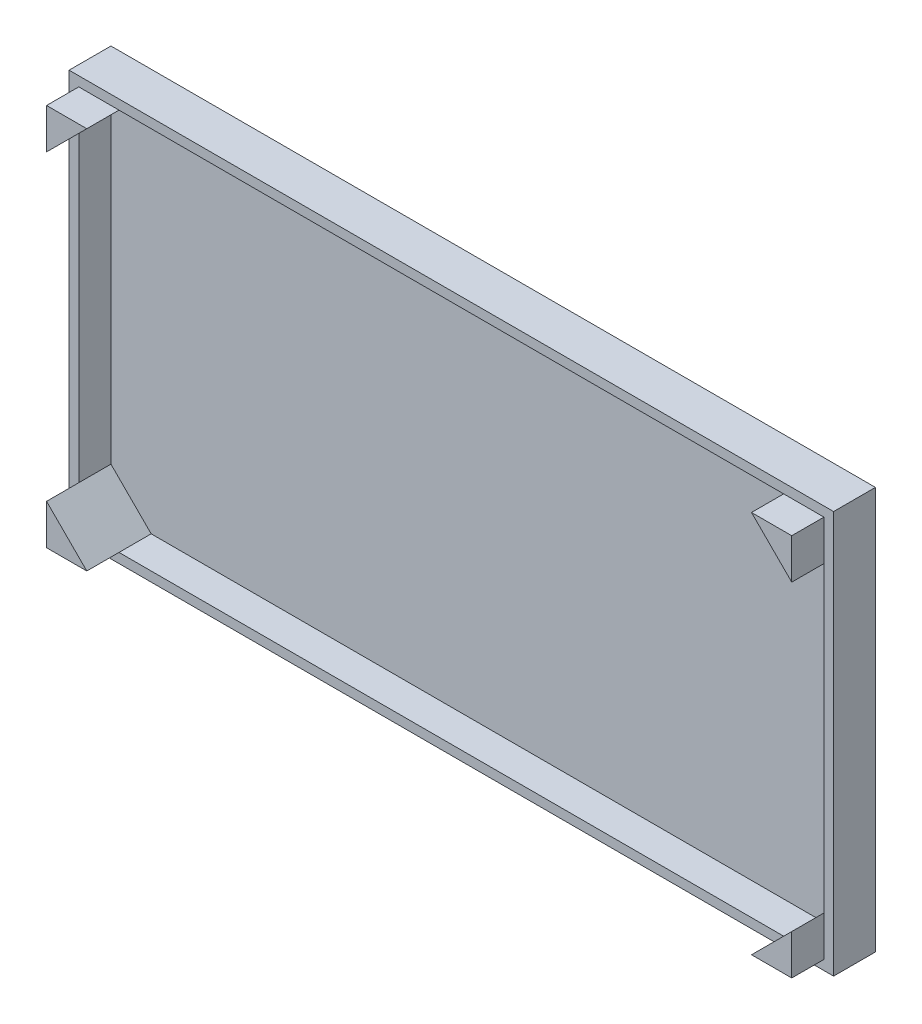
from build123d import *

# Parameters (mm, degrees)
SKICA1_W                = 95
SKICA1_H                = 50
P_IDAT_VYSUNUT_M1_DEPTH = 1.2
SKICA2_W                = 95
SKICA2_H                = 50
SKICA2_W_2              = 92.6
SKICA2_H_2              = 47.6
P_IDAT_VYSUNUT_M2_DEPTH = 4
P_IDAT_VYSUNUT_M3_DEPTH = 8


with BuildPart() as part:
    # Skica1 → Přidat vysunutím1 (new body)
    with BuildSketch(Plane.XY):
        with Locations((47.5, 25)):
            Rectangle(SKICA1_W, SKICA1_H)
    extrude(amount=P_IDAT_VYSUNUT_M1_DEPTH)

    # Skica2 → Přidat vysunutím2 (add)
    with BuildSketch(Plane.XY.offset(1.2)):
        with Locations((47.5, 25)):
            Rectangle(SKICA2_W, SKICA2_H)
        with Locations((47.5, 25)):
            Rectangle(SKICA2_W_2, SKICA2_H_2, mode=Mode.SUBTRACT)
    extrude(amount=P_IDAT_VYSUNUT_M2_DEPTH)

    # Skica3 → Přidat vysunutím3 (add)
    with BuildSketch(Plane.XY.offset(1.2)):
        Polygon((1.2, 48.8), (6.2, 48.8), (1.2, 43.8), align=None)
        Polygon((93.8, 48.8), (93.8, 43.8), (88.8, 48.8), align=None)
        Polygon((93.8, 1.2), (88.8, 1.2), (93.8, 6.2), align=None)
        Polygon((1.2, 1.2), (1.2, 6.2), (6.2, 1.2), align=None)
    extrude(amount=P_IDAT_VYSUNUT_M3_DEPTH)


solid = part.part
